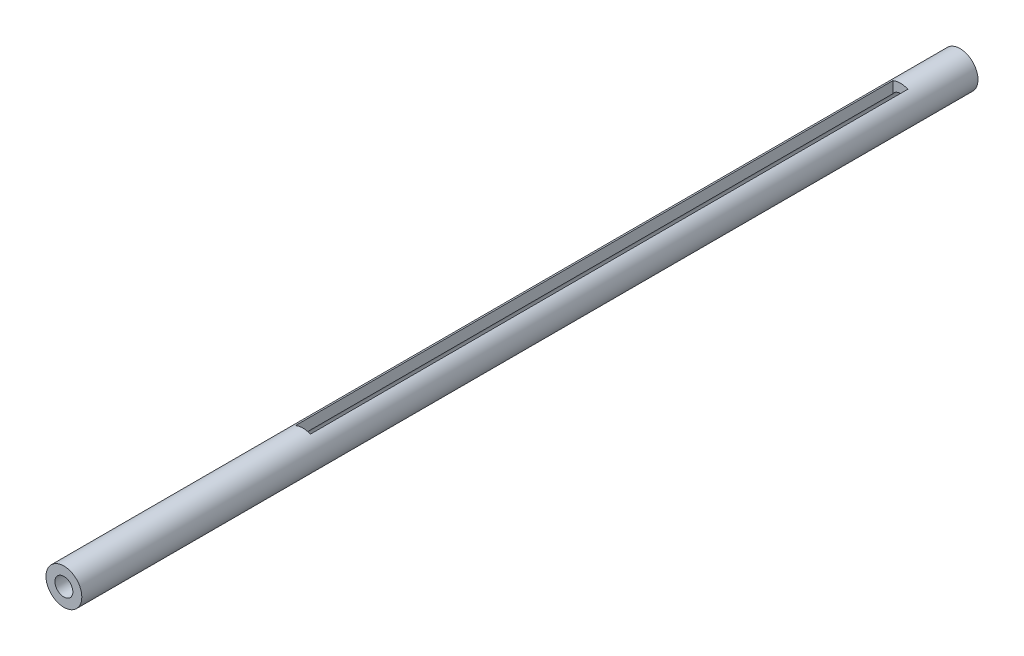
from build123d import *

# Parameters (mm, degrees)
SKETCH1_R           = 3
SKETCH1_R_2         = 1.5
BOSS_EXTRUDE1_DEPTH = 150
SKETCH2_W           = 2.5
SKETCH2_H           = 100
CUT_EXTRUDE1_DEPTH  = 100


with BuildPart() as part:
    # Sketch1 → Boss-Extrude1 (new body)
    with BuildSketch(Plane.XY):
        Circle(SKETCH1_R)
        Circle(SKETCH1_R_2, mode=Mode.SUBTRACT)
    extrude(amount=BOSS_EXTRUDE1_DEPTH)

    # Sketch2 → Cut-Extrude1 (cut)
    with BuildSketch(Plane(origin=(0, 0, 0), x_dir=(1, 0, 0), z_dir=(0, 1, 0))):
        with Locations((0, -60)):
            Rectangle(SKETCH2_W, SKETCH2_H)
    extrude(amount=CUT_EXTRUDE1_DEPTH, mode=Mode.SUBTRACT)


solid = part.part
